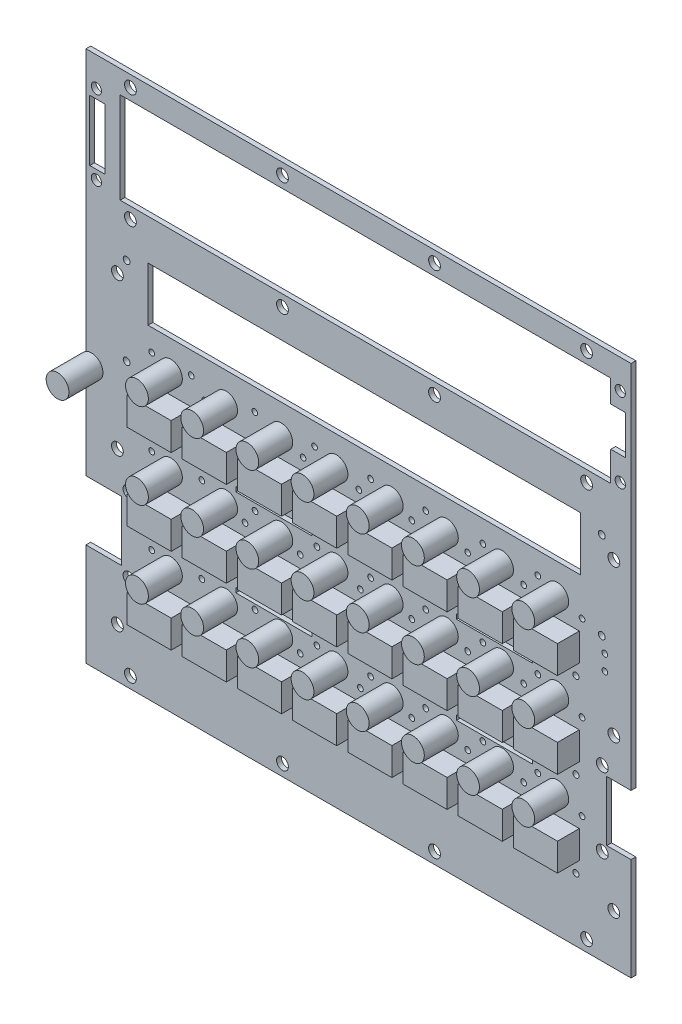
from build123d import *

# Parameters (mm, degrees)
SKETCH1_W                       = 144.56156
SKETCH1_H                       = 18.00098
SKETCH1_W_2                     = 5.08
SKETCH1_H_2                     = 20.32
SKETCH1_W_3                     = 25.4
SKETCH1_H_3                     = 1.5875
BOARD_DEPTH                     = 1.592072
SKETCH2_R                       = 3.81
LED_KINGBRIGHT_3P_2P54_1_DEPTH  = 11.3538
SKETCH3_R                       = 3.81
LED_KINGBRIGHT_3P_2P54_2_DEPTH  = 11.3538
SKETCH4_R                       = 3.81
LED_KINGBRIGHT_3P_2P54_3_DEPTH  = 11.3538
SKETCH5_R                       = 3.81
LED_KINGBRIGHT_3P_2P54_4_DEPTH  = 11.3538
SKETCH6_R                       = 3.81
LED_KINGBRIGHT_3P_2P54_5_DEPTH  = 11.3538
SKETCH7_R                       = 3.81
LED_KINGBRIGHT_3P_2P54_6_DEPTH  = 11.3538
SKETCH8_R                       = 3.81
LED_KINGBRIGHT_3P_2P54_7_DEPTH  = 11.3538
SKETCH9_R                       = 3.81
LED_KINGBRIGHT_3P_2P54_8_DEPTH  = 11.3538
SKETCH10_R                      = 3.81
LED_KINGBRIGHT_3P_2P54_9_DEPTH  = 11.3538
SKETCH11_R                      = 3.81
LED_KINGBRIGHT_3P_2P54_10_DEPTH = 11.3538
SKETCH12_R                      = 3.81
LED_KINGBRIGHT_3P_2P54_11_DEPTH = 11.3538
SKETCH13_R                      = 3.81
LED_KINGBRIGHT_3P_2P54_12_DEPTH = 11.3538
SKETCH14_R                      = 3.81
LED_KINGBRIGHT_3P_2P54_13_DEPTH = 11.3538
SKETCH15_R                      = 3.81
LED_KINGBRIGHT_3P_2P54_14_DEPTH = 11.3538
SKETCH16_R                      = 3.81
LED_KINGBRIGHT_3P_2P54_15_DEPTH = 11.3538
SKETCH17_R                      = 3.81
LED_KINGBRIGHT_3P_2P54_16_DEPTH = 11.3538
SKETCH18_R                      = 3.81
LED_KINGBRIGHT_3P_2P54_17_DEPTH = 11.3538
SKETCH19_R                      = 3.81
LED_KINGBRIGHT_3P_2P54_18_DEPTH = 11.3538
SKETCH20_R                      = 3.81
LED_KINGBRIGHT_3P_2P54_19_DEPTH = 11.3538
SKETCH21_R                      = 3.81
LED_KINGBRIGHT_3P_2P54_20_DEPTH = 11.3538
SKETCH22_R                      = 3.81
LED_KINGBRIGHT_3P_2P54_21_DEPTH = 11.3538
SKETCH23_R                      = 3.81
LED_KINGBRIGHT_3P_2P54_22_DEPTH = 11.3538
SKETCH24_R                      = 3.81
LED_KINGBRIGHT_3P_2P54_23_DEPTH = 11.3538
SKETCH25_R                      = 3.81
LED_KINGBRIGHT_3P_2P54_24_DEPTH = 11.3538
SKETCH26_R                      = 3.81
LED_KINGBRIGHT_3P_2P54_25_DEPTH = 11.3538
SKETCH27_W                      = 14.732
SKETCH27_H                      = 9.271
SWITCH_MCDTS2_1_DEPTH           = 7.3000108
SKETCH28_W                      = 14.732
SKETCH28_H                      = 9.271
SWITCH_MCDTS2_2_DEPTH           = 7.3000108
SKETCH29_W                      = 14.732
SKETCH29_H                      = 9.271
SWITCH_MCDTS2_3_DEPTH           = 7.3000108
SKETCH30_W                      = 14.732
SKETCH30_H                      = 9.271
SWITCH_MCDTS2_4_DEPTH           = 7.3000108
SKETCH31_W                      = 14.732
SKETCH31_H                      = 9.271
SWITCH_MCDTS2_5_DEPTH           = 7.3000108
SKETCH32_W                      = 14.732
SKETCH32_H                      = 9.271
SWITCH_MCDTS2_6_DEPTH           = 7.3000108
SKETCH33_W                      = 14.732
SKETCH33_H                      = 9.271
SWITCH_MCDTS2_7_DEPTH           = 7.3000108
SKETCH34_W                      = 14.732
SKETCH34_H                      = 9.271
SWITCH_MCDTS2_8_DEPTH           = 7.3000108
SKETCH35_W                      = 14.732
SKETCH35_H                      = 9.271
SWITCH_MCDTS2_9_DEPTH           = 7.3000108
SKETCH36_W                      = 14.732
SKETCH36_H                      = 9.271
SWITCH_MCDTS2_10_DEPTH          = 7.3000108
SKETCH37_W                      = 14.732
SKETCH37_H                      = 9.271
SWITCH_MCDTS2_11_DEPTH          = 7.3000108
SKETCH38_W                      = 14.732
SKETCH38_H                      = 9.271
SWITCH_MCDTS2_12_DEPTH          = 7.3000108
SKETCH39_W                      = 14.732
SKETCH39_H                      = 9.271
SWITCH_MCDTS2_13_DEPTH          = 7.3000108
SKETCH40_W                      = 14.732
SKETCH40_H                      = 9.271
SWITCH_MCDTS2_14_DEPTH          = 7.3000108
SKETCH41_W                      = 14.732
SKETCH41_H                      = 9.271
SWITCH_MCDTS2_15_DEPTH          = 7.3000108
SKETCH42_W                      = 14.732
SKETCH42_H                      = 9.271
SWITCH_MCDTS2_16_DEPTH          = 7.3000108
SKETCH43_W                      = 14.732
SKETCH43_H                      = 9.271
SWITCH_MCDTS2_17_DEPTH          = 7.3000108
SKETCH44_W                      = 14.732
SKETCH44_H                      = 9.271
SWITCH_MCDTS2_18_DEPTH          = 7.3000108
SKETCH45_W                      = 14.732
SKETCH45_H                      = 9.271
SWITCH_MCDTS2_19_DEPTH          = 7.3000108
SKETCH46_W                      = 14.732
SKETCH46_H                      = 9.271
SWITCH_MCDTS2_20_DEPTH          = 7.3000108
SKETCH47_W                      = 14.732
SKETCH47_H                      = 9.271
SWITCH_MCDTS2_21_DEPTH          = 7.3000108
SKETCH48_W                      = 14.732
SKETCH48_H                      = 9.271
SWITCH_MCDTS2_22_DEPTH          = 7.3000108
SKETCH49_W                      = 14.732
SKETCH49_H                      = 9.271
SWITCH_MCDTS2_23_DEPTH          = 7.3000108
SKETCH50_W                      = 14.732
SKETCH50_H                      = 9.271
SWITCH_MCDTS2_24_DEPTH          = 7.3000108
SKETCH56_R                      = 1.016
SKETCH56_R_2                    = 0.9652
SKETCH56_R_3                    = 0.9525
SKETCH56_R_4                    = 1.9685
SKETCH56_R_5                    = 1.1303
SKETCH56_R_6                    = 1.7145
CUT_EXTRUDE1_DEPTH              = 10


with BuildPart() as part:
    # Sketch1 → BOARD (new body)
    with BuildSketch(Plane.XY):
        Polygon((0, 0), (182.118, 0), (182.118, 34.24682), (173.98746, 34.24682), (173.98746, 54.24678), (182.118, 54.24678), (182.118, 177.8), (0, 177.8), (0, 54.24678), (11.86942, 54.24678), (11.86942, 34.24682), (0, 34.24682), align=None)
        with Locations((93.01988, 117.17909)):
            Rectangle(SKETCH1_W, SKETCH1_H, mode=Mode.SUBTRACT)
        with Locations((3.81, 154.813)):
            Rectangle(SKETCH1_W_2, SKETCH1_H_2, mode=Mode.SUBTRACT)
        Polygon((12.7, 170.18), (175.26, 170.18), (175.26, 162.6616), (180.086, 162.6616), (180.2892, 162.4584), (180.2892, 149.606), (175.3616, 149.606), (175.26, 149.5044), (175.26, 139.7), (12.7, 139.7), (11.43, 139.7), (11.43, 170.18), align=None, mode=Mode.SUBTRACT)
        with Locations((62.7634, 46.20895)):
            Rectangle(SKETCH1_W_3, SKETCH1_H_3, mode=Mode.SUBTRACT)
        with Locations((136.5134176, 46.20895)):
            Rectangle(SKETCH1_W_3, SKETCH1_H_3, mode=Mode.SUBTRACT)
        with Locations((136.5134176, 75.41895)):
            Rectangle(SKETCH1_W_3, SKETCH1_H_3, mode=Mode.SUBTRACT)
        with Locations((62.7634, 75.41895)):
            Rectangle(SKETCH1_W_3, SKETCH1_H_3, mode=Mode.SUBTRACT)
    extrude(amount=BOARD_DEPTH)

    # Sketch56 → Cut-Extrude1 (cut)
    with BuildSketch(Plane.XY.offset(1.592072)):
        with Locations((163.703, 21.1074)):
            Circle(SKETCH56_R)
        with Locations((163.703, 49.6824)):
            Circle(SKETCH56_R)
        with Locations((145.2626, 21.8186)):
            Circle(SKETCH56_R_2)
        with Locations((126.8476, 21.6154)):
            Circle(SKETCH56_R_2)
        with Locations((108.4072, 21.7424)):
            Circle(SKETCH56_R_2)
        with Locations((89.9668, 21.844)):
            Circle(SKETCH56_R_2)
        with Locations((71.5264, 20.7772)):
            Circle(SKETCH56_R_2)
        with Locations((53.086, 21.1582)):
            Circle(SKETCH56_R_2)
        with Locations((34.6472002, 21.1328)):
            Circle(SKETCH56_R)
        with Locations((145.2626, 49.5554)):
            Circle(SKETCH56_R)
        with Locations((126.8222, 49.3522)):
            Circle(SKETCH56_R)
        with Locations((108.3818, 49.1236)):
            Circle(SKETCH56_R)
        with Locations((89.9414, 49.6824)):
            Circle(SKETCH56_R)
        with Locations((71.501, 49.1998)):
            Circle(SKETCH56_R)
        with Locations((53.0606, 49.1998)):
            Circle(SKETCH56_R)
        with Locations((34.6202, 49.276)):
            Circle(SKETCH56_R)
        with Locations((163.703, 78.2574)):
            Circle(SKETCH56_R)
        with Locations((145.2626, 77.7748)):
            Circle(SKETCH56_R)
        with Locations((126.746, 78.3336)):
            Circle(SKETCH56_R)
        with Locations((108.3818, 78.74)):
            Circle(SKETCH56_R)
        with Locations((89.9414, 78.3336)):
            Circle(SKETCH56_R)
        with Locations((71.501, 78.2574)):
            Circle(SKETCH56_R)
        with Locations((53.0606, 78.4098)):
            Circle(SKETCH56_R)
        with Locations((34.6202, 78.0542)):
            Circle(SKETCH56_R)
        with Locations((91.694, 38.6588)):
            Circle(SKETCH56_R_3)
        with Locations((77.1652, 43.7388)):
            Circle(SKETCH56_R_3)
        with Locations((71.5772, 38.6588)):
            Circle(SKETCH56_R_3)
        with Locations((56.4896, 43.7388)):
            Circle(SKETCH56_R_3)
        with Locations((38.735, 43.7388)):
            Circle(SKETCH56_R_3)
        with Locations((21.8948, 38.6588)):
            Circle(SKETCH56_R_3)
        with Locations((21.971, 43.7388)):
            Circle(SKETCH56_R_3)
        with Locations((77.1652, 72.3138)):
            Circle(SKETCH56_R_3)
        with Locations((91.694, 67.2338)):
            Circle(SKETCH56_R_3)
        with Locations((71.5772, 67.2338)):
            Circle(SKETCH56_R_3)
        with Locations((56.4896, 72.3138)):
            Circle(SKETCH56_R_3)
        with Locations((53.1368, 67.2338)):
            Circle(SKETCH56_R_3)
        with Locations((38.735, 72.3138)):
            Circle(SKETCH56_R_3)
        with Locations((21.8948, 67.2338)):
            Circle(SKETCH56_R_3)
        with Locations((21.971, 72.3138)):
            Circle(SKETCH56_R_3)
        with Locations((165.735, 95.8088)):
            Circle(SKETCH56_R_3)
        with Locations((150.9776, 100.8888)):
            Circle(SKETCH56_R_3)
        with Locations((146.2278, 95.8088)):
            Circle(SKETCH56_R_3)
        with Locations((132.6134, 100.8888)):
            Circle(SKETCH56_R_3)
        with Locations((113.4872, 100.8888)):
            Circle(SKETCH56_R_3)
        with Locations((127.508, 95.8088)):
            Circle(SKETCH56_R_3)
        with Locations((108.8644, 95.8088)):
            Circle(SKETCH56_R_3)
        with Locations((95.0976, 100.8888)):
            Circle(SKETCH56_R_3)
        with Locations((91.186, 95.8088)):
            Circle(SKETCH56_R_3)
        with Locations((76.3778, 100.8888)):
            Circle(SKETCH56_R_3)
        with Locations((72.5424, 95.8088)):
            Circle(SKETCH56_R_3)
        with Locations((56.4134, 100.8888)):
            Circle(SKETCH56_R_3)
        with Locations((39.7256, 95.8088)):
            Circle(SKETCH56_R_3)
        with Locations((35.179, 100.8888)):
            Circle(SKETCH56_R_3)
        with Locations((24.2062, 95.8088)):
            Circle(SKETCH56_R_3)
        with Locations((21.971, 100.8888)):
            Circle(SKETCH56_R_3)
        with Locations((132.6134, 72.3138)):
            Circle(SKETCH56_R_3)
        with Locations((146.2278, 67.2338)):
            Circle(SKETCH56_R_3)
        with Locations((113.4872, 72.3138)):
            Circle(SKETCH56_R_3)
        with Locations((127.508, 67.2338)):
            Circle(SKETCH56_R_3)
        with Locations((95.0976, 72.3138)):
            Circle(SKETCH56_R_3)
        with Locations((108.8644, 67.2338)):
            Circle(SKETCH56_R_3)
        with Locations((150.9776, 43.7388)):
            Circle(SKETCH56_R_3)
        with Locations((132.6134, 43.7388)):
            Circle(SKETCH56_R_3)
        with Locations((113.4872, 43.7388)):
            Circle(SKETCH56_R_3)
        with Locations((95.0976, 43.7388)):
            Circle(SKETCH56_R_3)
        with Locations((108.8644, 38.6588)):
            Circle(SKETCH56_R_3)
        with Locations((150.9776, 72.3138)):
            Circle(SKETCH56_R_3)
        with Locations((165.735, 67.2338)):
            Circle(SKETCH56_R_3)
        with Locations((173.3296, 89.4588)):
            Circle(SKETCH56_R_3)
        with Locations((173.355, 84.3534)):
            Circle(SKETCH56_R_3)
        with Locations((176.37252, 118.11)):
            Circle(SKETCH56_R_4)
        with Locations((176.37252, 67.31)):
            Circle(SKETCH56_R_4)
        with Locations((176.37252, 16.51)):
            Circle(SKETCH56_R_4)
        with Locations((167.259, 135.89)):
            Circle(SKETCH56_R_4)
        with Locations((116.459, 135.89)):
            Circle(SKETCH56_R_4)
        with Locations((65.659, 135.89)):
            Circle(SKETCH56_R_4)
        with Locations((14.859, 135.89)):
            Circle(SKETCH56_R_4)
        with Locations((10.51052, 118.11)):
            Circle(SKETCH56_R_4)
        with Locations((10.51052, 67.31)):
            Circle(SKETCH56_R_4)
        with Locations((10.51052, 16.51)):
            Circle(SKETCH56_R_4)
        with Locations((165.735, 38.6588)):
            Circle(SKETCH56_R_3)
        with Locations((146.2278, 38.6588)):
            Circle(SKETCH56_R_3)
        with Locations((127.508, 38.6588)):
            Circle(SKETCH56_R_3)
        with Locations((14.859, 173.99)):
            Circle(SKETCH56_R_4)
        with Locations((65.659, 173.99)):
            Circle(SKETCH56_R_4)
        with Locations((116.459, 173.99)):
            Circle(SKETCH56_R_4)
        with Locations((167.259, 173.99)):
            Circle(SKETCH56_R_4)
        with Locations((167.259, 3.81)):
            Circle(SKETCH56_R_4)
        with Locations((116.459, 3.81)):
            Circle(SKETCH56_R_4)
        with Locations((65.659, 3.81)):
            Circle(SKETCH56_R_4)
        with Locations((14.859, 3.81)):
            Circle(SKETCH56_R_4)
        with Locations((172.50664, 56.7436)):
            Circle(SKETCH56_R_4)
        with Locations((172.50664, 31.75)):
            Circle(SKETCH56_R_4)
        with Locations((14.36878, 56.7436)):
            Circle(SKETCH56_R_4)
        with Locations((14.36878, 31.75)):
            Circle(SKETCH56_R_4)
        with Locations((172.34154, 123.37542)):
            Circle(SKETCH56_R_5)
        with Locations((172.34154, 94.16542)):
            Circle(SKETCH56_R_5)
        with Locations((13.59154, 94.16542)):
            Circle(SKETCH56_R_5)
        with Locations((13.59154, 123.37542)):
            Circle(SKETCH56_R_5)
        with Locations((178.51374, 141.56182)):
            Circle(SKETCH56_R_6)
        with Locations((178.51374, 168.06164)):
            Circle(SKETCH56_R_6)
        with Locations((3.50012, 168.06164)):
            Circle(SKETCH56_R_6)
        with Locations((3.50012, 141.56182)):
            Circle(SKETCH56_R_6)
    extrude(amount=-CUT_EXTRUDE1_DEPTH, mode=Mode.SUBTRACT)


with BuildPart() as body_2:
    # Sketch2 → LED-KINGBRIGHT_3P_2P54-1 (new body)
    with BuildSketch(Plane.XY.offset(1.592072)):
        with Locations((1.86944, 86.9188)):
            Circle(SKETCH2_R)
    extrude(amount=LED_KINGBRIGHT_3P_2P54_1_DEPTH)


with BuildPart() as body_3:
    # Sketch3 → LED-KINGBRIGHT_3P_2P54-2 (new body)
    with BuildSketch(Plane.XY.offset(1.592072)):
        with Locations((157.4597054, 41.1988)):
            Circle(SKETCH3_R)
    extrude(amount=LED_KINGBRIGHT_3P_2P54_2_DEPTH)


with BuildPart() as body_4:
    # Sketch4 → LED-KINGBRIGHT_3P_2P54-3 (new body)
    with BuildSketch(Plane.XY.offset(1.592072)):
        with Locations((139.022201, 41.1988)):
            Circle(SKETCH4_R)
    extrude(amount=LED_KINGBRIGHT_3P_2P54_3_DEPTH)


with BuildPart() as body_5:
    # Sketch5 → LED-KINGBRIGHT_3P_2P54-4 (new body)
    with BuildSketch(Plane.XY.offset(1.592072)):
        with Locations((120.5846966, 41.1988)):
            Circle(SKETCH5_R)
    extrude(amount=LED_KINGBRIGHT_3P_2P54_4_DEPTH)


with BuildPart() as body_6:
    # Sketch6 → LED-KINGBRIGHT_3P_2P54-5 (new body)
    with BuildSketch(Plane.XY.offset(1.592072)):
        with Locations((102.1472176, 41.1988)):
            Circle(SKETCH6_R)
    extrude(amount=LED_KINGBRIGHT_3P_2P54_5_DEPTH)


with BuildPart() as body_7:
    # Sketch7 → LED-KINGBRIGHT_3P_2P54-6 (new body)
    with BuildSketch(Plane.XY.offset(1.592072)):
        with Locations((157.4597308, 69.7738)):
            Circle(SKETCH7_R)
    extrude(amount=LED_KINGBRIGHT_3P_2P54_6_DEPTH)


with BuildPart() as body_8:
    # Sketch8 → LED-KINGBRIGHT_3P_2P54-7 (new body)
    with BuildSketch(Plane.XY.offset(1.592072)):
        with Locations((139.0222264, 69.7738)):
            Circle(SKETCH8_R)
    extrude(amount=LED_KINGBRIGHT_3P_2P54_7_DEPTH)


with BuildPart() as body_9:
    # Sketch9 → LED-KINGBRIGHT_3P_2P54-8 (new body)
    with BuildSketch(Plane.XY.offset(1.592072)):
        with Locations((120.584722, 69.7738)):
            Circle(SKETCH9_R)
    extrude(amount=LED_KINGBRIGHT_3P_2P54_8_DEPTH)


with BuildPart() as body_10:
    # Sketch10 → LED-KINGBRIGHT_3P_2P54-9 (new body)
    with BuildSketch(Plane.XY.offset(1.592072)):
        with Locations((102.1472176, 69.7738)):
            Circle(SKETCH10_R)
    extrude(amount=LED_KINGBRIGHT_3P_2P54_9_DEPTH)


with BuildPart() as body_11:
    # Sketch11 → LED-KINGBRIGHT_3P_2P54-10 (new body)
    with BuildSketch(Plane.XY.offset(1.592072)):
        with Locations((83.7097132, 41.1988)):
            Circle(SKETCH11_R)
    extrude(amount=LED_KINGBRIGHT_3P_2P54_10_DEPTH)


with BuildPart() as body_12:
    # Sketch12 → LED-KINGBRIGHT_3P_2P54-11 (new body)
    with BuildSketch(Plane.XY.offset(1.592072)):
        with Locations((65.2722088, 41.1988)):
            Circle(SKETCH12_R)
    extrude(amount=LED_KINGBRIGHT_3P_2P54_11_DEPTH)


with BuildPart() as body_13:
    # Sketch13 → LED-KINGBRIGHT_3P_2P54-12 (new body)
    with BuildSketch(Plane.XY.offset(1.592072)):
        with Locations((46.8347044, 41.1988)):
            Circle(SKETCH13_R)
    extrude(amount=LED_KINGBRIGHT_3P_2P54_12_DEPTH)


with BuildPart() as body_14:
    # Sketch14 → LED-KINGBRIGHT_3P_2P54-13 (new body)
    with BuildSketch(Plane.XY.offset(1.592072)):
        with Locations((28.3972, 41.1988)):
            Circle(SKETCH14_R)
    extrude(amount=LED_KINGBRIGHT_3P_2P54_13_DEPTH)


with BuildPart() as body_15:
    # Sketch15 → LED-KINGBRIGHT_3P_2P54-14 (new body)
    with BuildSketch(Plane.XY.offset(1.592072)):
        with Locations((83.7097132, 69.7738)):
            Circle(SKETCH15_R)
    extrude(amount=LED_KINGBRIGHT_3P_2P54_14_DEPTH)


with BuildPart() as body_16:
    # Sketch16 → LED-KINGBRIGHT_3P_2P54-15 (new body)
    with BuildSketch(Plane.XY.offset(1.592072)):
        with Locations((65.2722088, 69.7738)):
            Circle(SKETCH16_R)
    extrude(amount=LED_KINGBRIGHT_3P_2P54_15_DEPTH)


with BuildPart() as body_17:
    # Sketch17 → LED-KINGBRIGHT_3P_2P54-16 (new body)
    with BuildSketch(Plane.XY.offset(1.592072)):
        with Locations((46.8347044, 69.7738)):
            Circle(SKETCH17_R)
    extrude(amount=LED_KINGBRIGHT_3P_2P54_16_DEPTH)


with BuildPart() as body_18:
    # Sketch18 → LED-KINGBRIGHT_3P_2P54-17 (new body)
    with BuildSketch(Plane.XY.offset(1.592072)):
        with Locations((28.3972, 69.7738)):
            Circle(SKETCH18_R)
    extrude(amount=LED_KINGBRIGHT_3P_2P54_17_DEPTH)


with BuildPart() as body_19:
    # Sketch19 → LED-KINGBRIGHT_3P_2P54-18 (new body)
    with BuildSketch(Plane.XY.offset(1.592072)):
        with Locations((157.4597308, 98.3488)):
            Circle(SKETCH19_R)
    extrude(amount=LED_KINGBRIGHT_3P_2P54_18_DEPTH)


with BuildPart() as body_20:
    # Sketch20 → LED-KINGBRIGHT_3P_2P54-19 (new body)
    with BuildSketch(Plane.XY.offset(1.592072)):
        with Locations((139.0222264, 98.3488)):
            Circle(SKETCH20_R)
    extrude(amount=LED_KINGBRIGHT_3P_2P54_19_DEPTH)


with BuildPart() as body_21:
    # Sketch21 → LED-KINGBRIGHT_3P_2P54-20 (new body)
    with BuildSketch(Plane.XY.offset(1.592072)):
        with Locations((120.584722, 98.3488)):
            Circle(SKETCH21_R)
    extrude(amount=LED_KINGBRIGHT_3P_2P54_20_DEPTH)


with BuildPart() as body_22:
    # Sketch22 → LED-KINGBRIGHT_3P_2P54-21 (new body)
    with BuildSketch(Plane.XY.offset(1.592072)):
        with Locations((102.1472176, 98.3488)):
            Circle(SKETCH22_R)
    extrude(amount=LED_KINGBRIGHT_3P_2P54_21_DEPTH)


with BuildPart() as body_23:
    # Sketch23 → LED-KINGBRIGHT_3P_2P54-22 (new body)
    with BuildSketch(Plane.XY.offset(1.592072)):
        with Locations((83.7097132, 98.3488)):
            Circle(SKETCH23_R)
    extrude(amount=LED_KINGBRIGHT_3P_2P54_22_DEPTH)


with BuildPart() as body_24:
    # Sketch24 → LED-KINGBRIGHT_3P_2P54-23 (new body)
    with BuildSketch(Plane.XY.offset(1.592072)):
        with Locations((65.2722088, 98.3488)):
            Circle(SKETCH24_R)
    extrude(amount=LED_KINGBRIGHT_3P_2P54_23_DEPTH)


with BuildPart() as body_25:
    # Sketch25 → LED-KINGBRIGHT_3P_2P54-24 (new body)
    with BuildSketch(Plane.XY.offset(1.592072)):
        with Locations((46.8347044, 98.3488)):
            Circle(SKETCH25_R)
    extrude(amount=LED_KINGBRIGHT_3P_2P54_24_DEPTH)


with BuildPart() as body_26:
    # Sketch26 → LED-KINGBRIGHT_3P_2P54-25 (new body)
    with BuildSketch(Plane.XY.offset(1.592072)):
        with Locations((28.3972, 98.3488)):
            Circle(SKETCH26_R)
    extrude(amount=LED_KINGBRIGHT_3P_2P54_25_DEPTH)


with BuildPart() as body_27:
    # Sketch27 → SWITCH-MCDTS2-1 (new body)
    with BuildSketch(Plane.XY.offset(1.592072)):
        with Locations((157.4597308, 29.9593)):
            Rectangle(SKETCH27_W, SKETCH27_H)
    extrude(amount=SWITCH_MCDTS2_1_DEPTH)


with BuildPart() as body_28:
    # Sketch28 → SWITCH-MCDTS2-2 (new body)
    with BuildSketch(Plane.XY.offset(1.592072)):
        with Locations((157.4597308, 58.5343)):
            Rectangle(SKETCH28_W, SKETCH28_H)
    extrude(amount=SWITCH_MCDTS2_2_DEPTH)


with BuildPart() as body_29:
    # Sketch29 → SWITCH-MCDTS2-3 (new body)
    with BuildSketch(Plane.XY.offset(1.592072)):
        with Locations((139.0222264, 29.9593)):
            Rectangle(SKETCH29_W, SKETCH29_H)
    extrude(amount=SWITCH_MCDTS2_3_DEPTH)


with BuildPart() as body_30:
    # Sketch30 → SWITCH-MCDTS2-4 (new body)
    with BuildSketch(Plane.XY.offset(1.592072)):
        with Locations((120.584722, 29.9593)):
            Rectangle(SKETCH30_W, SKETCH30_H)
    extrude(amount=SWITCH_MCDTS2_4_DEPTH)


with BuildPart() as body_31:
    # Sketch31 → SWITCH-MCDTS2-5 (new body)
    with BuildSketch(Plane.XY.offset(1.592072)):
        with Locations((102.1472176, 29.9593)):
            Rectangle(SKETCH31_W, SKETCH31_H)
    extrude(amount=SWITCH_MCDTS2_5_DEPTH)


with BuildPart() as body_32:
    # Sketch32 → SWITCH-MCDTS2-6 (new body)
    with BuildSketch(Plane.XY.offset(1.592072)):
        with Locations((83.7097132, 29.9593)):
            Rectangle(SKETCH32_W, SKETCH32_H)
    extrude(amount=SWITCH_MCDTS2_6_DEPTH)


with BuildPart() as body_33:
    # Sketch33 → SWITCH-MCDTS2-7 (new body)
    with BuildSketch(Plane.XY.offset(1.592072)):
        with Locations((65.2722088, 29.9593)):
            Rectangle(SKETCH33_W, SKETCH33_H)
    extrude(amount=SWITCH_MCDTS2_7_DEPTH)


with BuildPart() as body_34:
    # Sketch34 → SWITCH-MCDTS2-8 (new body)
    with BuildSketch(Plane.XY.offset(1.592072)):
        with Locations((46.8347044, 29.9593)):
            Rectangle(SKETCH34_W, SKETCH34_H)
    extrude(amount=SWITCH_MCDTS2_8_DEPTH)


with BuildPart() as body_35:
    # Sketch35 → SWITCH-MCDTS2-9 (new body)
    with BuildSketch(Plane.XY.offset(1.592072)):
        with Locations((28.3972, 29.9593)):
            Rectangle(SKETCH35_W, SKETCH35_H)
    extrude(amount=SWITCH_MCDTS2_9_DEPTH)


with BuildPart() as body_36:
    # Sketch36 → SWITCH-MCDTS2-10 (new body)
    with BuildSketch(Plane.XY.offset(1.592072)):
        with Locations((139.0222264, 58.5343)):
            Rectangle(SKETCH36_W, SKETCH36_H)
    extrude(amount=SWITCH_MCDTS2_10_DEPTH)


with BuildPart() as body_37:
    # Sketch37 → SWITCH-MCDTS2-11 (new body)
    with BuildSketch(Plane.XY.offset(1.592072)):
        with Locations((120.584722, 58.5343)):
            Rectangle(SKETCH37_W, SKETCH37_H)
    extrude(amount=SWITCH_MCDTS2_11_DEPTH)


with BuildPart() as body_38:
    # Sketch38 → SWITCH-MCDTS2-12 (new body)
    with BuildSketch(Plane.XY.offset(1.592072)):
        with Locations((102.1472176, 58.5343)):
            Rectangle(SKETCH38_W, SKETCH38_H)
    extrude(amount=SWITCH_MCDTS2_12_DEPTH)


with BuildPart() as body_39:
    # Sketch39 → SWITCH-MCDTS2-13 (new body)
    with BuildSketch(Plane.XY.offset(1.592072)):
        with Locations((83.7097132, 58.5343)):
            Rectangle(SKETCH39_W, SKETCH39_H)
    extrude(amount=SWITCH_MCDTS2_13_DEPTH)


with BuildPart() as body_40:
    # Sketch40 → SWITCH-MCDTS2-14 (new body)
    with BuildSketch(Plane.XY.offset(1.592072)):
        with Locations((65.2722088, 58.5343)):
            Rectangle(SKETCH40_W, SKETCH40_H)
    extrude(amount=SWITCH_MCDTS2_14_DEPTH)


with BuildPart() as body_41:
    # Sketch41 → SWITCH-MCDTS2-15 (new body)
    with BuildSketch(Plane.XY.offset(1.592072)):
        with Locations((46.8347044, 58.5343)):
            Rectangle(SKETCH41_W, SKETCH41_H)
    extrude(amount=SWITCH_MCDTS2_15_DEPTH)


with BuildPart() as body_42:
    # Sketch42 → SWITCH-MCDTS2-16 (new body)
    with BuildSketch(Plane.XY.offset(1.592072)):
        with Locations((28.3972, 58.5343)):
            Rectangle(SKETCH42_W, SKETCH42_H)
    extrude(amount=SWITCH_MCDTS2_16_DEPTH)


with BuildPart() as body_43:
    # Sketch43 → SWITCH-MCDTS2-17 (new body)
    with BuildSketch(Plane.XY.offset(1.592072)):
        with Locations((157.4597308, 87.1093)):
            Rectangle(SKETCH43_W, SKETCH43_H)
    extrude(amount=SWITCH_MCDTS2_17_DEPTH)


with BuildPart() as body_44:
    # Sketch44 → SWITCH-MCDTS2-18 (new body)
    with BuildSketch(Plane.XY.offset(1.592072)):
        with Locations((139.0222264, 87.1093)):
            Rectangle(SKETCH44_W, SKETCH44_H)
    extrude(amount=SWITCH_MCDTS2_18_DEPTH)


with BuildPart() as body_45:
    # Sketch45 → SWITCH-MCDTS2-19 (new body)
    with BuildSketch(Plane.XY.offset(1.592072)):
        with Locations((120.584722, 87.1093)):
            Rectangle(SKETCH45_W, SKETCH45_H)
    extrude(amount=SWITCH_MCDTS2_19_DEPTH)


with BuildPart() as body_46:
    # Sketch46 → SWITCH-MCDTS2-20 (new body)
    with BuildSketch(Plane.XY.offset(1.592072)):
        with Locations((102.1472176, 87.1093)):
            Rectangle(SKETCH46_W, SKETCH46_H)
    extrude(amount=SWITCH_MCDTS2_20_DEPTH)


with BuildPart() as body_47:
    # Sketch47 → SWITCH-MCDTS2-21 (new body)
    with BuildSketch(Plane.XY.offset(1.592072)):
        with Locations((83.7097132, 87.1093)):
            Rectangle(SKETCH47_W, SKETCH47_H)
    extrude(amount=SWITCH_MCDTS2_21_DEPTH)


with BuildPart() as body_48:
    # Sketch48 → SWITCH-MCDTS2-22 (new body)
    with BuildSketch(Plane.XY.offset(1.592072)):
        with Locations((65.2722088, 87.1093)):
            Rectangle(SKETCH48_W, SKETCH48_H)
    extrude(amount=SWITCH_MCDTS2_22_DEPTH)


with BuildPart() as body_49:
    # Sketch49 → SWITCH-MCDTS2-23 (new body)
    with BuildSketch(Plane.XY.offset(1.592072)):
        with Locations((46.8347044, 87.1093)):
            Rectangle(SKETCH49_W, SKETCH49_H)
    extrude(amount=SWITCH_MCDTS2_23_DEPTH)


with BuildPart() as body_50:
    # Sketch50 → SWITCH-MCDTS2-24 (new body)
    with BuildSketch(Plane.XY.offset(1.592072)):
        with Locations((28.3972, 87.1093)):
            Rectangle(SKETCH50_W, SKETCH50_H)
    extrude(amount=SWITCH_MCDTS2_24_DEPTH)


solid = Compound([part.part, body_2.part, body_3.part, body_4.part, body_5.part, body_6.part, body_7.part, body_8.part, body_9.part, body_10.part, body_11.part, body_12.part, body_13.part, body_14.part, body_15.part, body_16.part, body_17.part, body_18.part, body_19.part, body_20.part, body_21.part, body_22.part, body_23.part, body_24.part, body_25.part, body_26.part, body_27.part, body_28.part, body_29.part, body_30.part, body_31.part, body_32.part, body_33.part, body_34.part, body_35.part, body_36.part, body_37.part, body_38.part, body_39.part, body_40.part, body_41.part, body_42.part, body_43.part, body_44.part, body_45.part, body_46.part, body_47.part, body_48.part, body_49.part, body_50.part])
